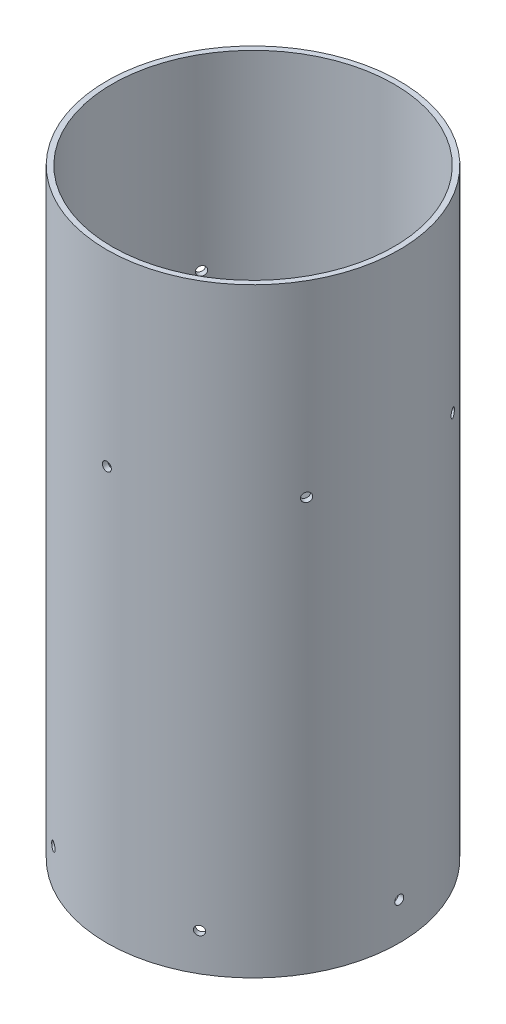
from build123d import *

# Parameters (mm, degrees)
SKETCH1_R           = 49.5046
SKETCH1_R_2         = 47.6885
BOSS_EXTRUDE1_DEPTH = 203.2
SKETCH2_R           = 1.524
CUT_EXTRUDE1_DEPTH  = 81.534
CIRPATTERN1_COUNT   = 6
SKETCH3_R           = 1.524
CUT_EXTRUDE2_DEPTH  = 81.534
CIRPATTERN2_COUNT   = 6


with BuildPart() as part:
    # Sketch1 → Boss-Extrude1 (new body)
    with BuildSketch(Plane(origin=(0, 0, 0), x_dir=(1, 0, 0), z_dir=(0, 1, 0))):
        with Locations(Location((0, 0, 0), (0, 0, 270))):
            Circle(SKETCH1_R)
        with Locations(Location((0, 0, 0), (0, 0, 270))):
            Circle(SKETCH1_R_2, mode=Mode.SUBTRACT)
    extrude(amount=BOSS_EXTRUDE1_DEPTH)

    # Sketch2 → Cut-Extrude1 (cut)
    with BuildSketch(Plane.XY):
        with Locations(Location((0, 139.7, 0), (0, 0, 90))):
            Circle(SKETCH2_R)
    cut_extrude1 = extrude(amount=-CUT_EXTRUDE1_DEPTH, mode=Mode.SUBTRACT)

    # CirPattern1: Cut-Extrude1 ×6 about axis
    cirpattern1_axis = Axis((0, 203.2, 0), (0, -1, 0))
    for i in range(1, CIRPATTERN1_COUNT):
        add(cut_extrude1.rotate(cirpattern1_axis, i * 360 / CIRPATTERN1_COUNT), mode=Mode.SUBTRACT)

    # Sketch3 → Cut-Extrude2 (cut)
    with BuildSketch(Plane(origin=(0, 0, 0), x_dir=(0, 0, -1), z_dir=(1, 0, 0))):
        with Locations((0, 12.7)):
            Circle(SKETCH3_R)
    cut_extrude2 = extrude(amount=-CUT_EXTRUDE2_DEPTH, mode=Mode.SUBTRACT)

    # CirPattern2: Cut-Extrude2 ×6 about axis
    cirpattern2_axis = Axis((0, 203.2, 0), (0, -1, 0))
    for i in range(1, CIRPATTERN2_COUNT):
        add(cut_extrude2.rotate(cirpattern2_axis, i * 360 / CIRPATTERN2_COUNT), mode=Mode.SUBTRACT)


solid = part.part
